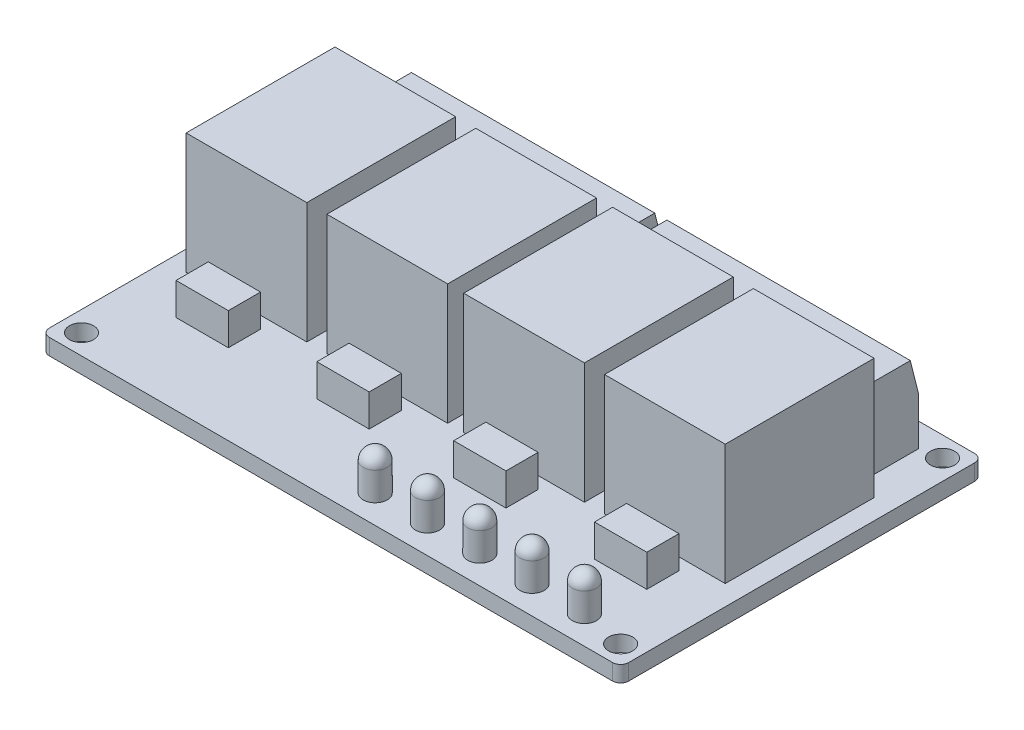
from build123d import *

# Parameters (mm, degrees)
SKETCH1_R           = 1.5
BOSS_EXTRUDE1_DEPTH = 2
SKETCH2_W           = 30.25
SKETCH2_H           = 7
BOSS_EXTRUDE2_DEPTH = 10
CUT_EXTRUDE1_DEPTH  = 72.688562547
SKETCH4_W           = 15
SKETCH4_H           = 18.5
BOSS_EXTRUDE3_DEPTH = 15
SKETCH5_W           = 6.5
SKETCH5_H           = 4
BOSS_EXTRUDE4_DEPTH = 4
SKETCH6_R           = 1.5
BOSS_EXTRUDE5_DEPTH = 5
FILLET1_R           = 1.5
FILLET2_R           = 1.5
FILLET3_R           = 1.5
FILLET4_R           = 1.5
FILLET5_R           = 1.5


with BuildPart() as part:
    # Sketch1 → Boss-Extrude1 (new body)
    with BuildSketch(Plane(origin=(0, 0, 0), x_dir=(1, 0, 0), z_dir=(0, 1, 0))):
        with BuildLine():
            Line((-35, -22.5), (35, -22.5))
            ThreePointArc((35, -22.5), (35.707106781, -22.207106781), (36, -21.5))
            Line((36, -21.5), (36, 21.5))
            ThreePointArc((36, 21.5), (35.707106781, 22.207106781), (35, 22.5))
            Line((35, 22.5), (-35, 22.5))
            ThreePointArc((-35, 22.5), (-35.707106781, 22.207106781), (-36, 21.5))
            Line((-36, 21.5), (-36, -21.5))
            ThreePointArc((-36, -21.5), (-35.707106781, -22.207106781), (-35, -22.5))
        make_face()
        with Locations(Location((-33.5, 20, 0), (0, 0, 270))):
            Circle(SKETCH1_R, mode=Mode.SUBTRACT)
        with Locations(Location((33.5, 20, 0), (0, 0, 90))):
            Circle(SKETCH1_R, mode=Mode.SUBTRACT)
        with Locations(Location((33.5, -20, 0), (0, 0, 270))):
            Circle(SKETCH1_R, mode=Mode.SUBTRACT)
        with Locations(Location((-33.5, -20, 0), (0, 0, 90))):
            Circle(SKETCH1_R, mode=Mode.SUBTRACT)
    extrude(amount=BOSS_EXTRUDE1_DEPTH)

    # Sketch2 → Boss-Extrude2 (add)
    with BuildSketch(Plane(origin=(0, 2, 0), x_dir=(1, 0, 0), z_dir=(0, 1, 0))):
        with Locations((-15.875, 16)):
            Rectangle(SKETCH2_W, SKETCH2_H)
        with Locations((15.875, 16)):
            Rectangle(SKETCH2_W, SKETCH2_H)
    extrude(amount=BOSS_EXTRUDE2_DEPTH)

    # Sketch3 → Cut-Extrude1 (cut, through all)
    with BuildSketch(Plane.ZY.offset(31)):
        Polygon((-19.5, 8), (-18.5, 12), (-19.5, 12), align=None)
        Polygon((-12.5, 8), (-14, 12), (-12.5, 12), align=None)
    extrude(amount=-CUT_EXTRUDE1_DEPTH, mode=Mode.SUBTRACT)

    # Sketch4 → Boss-Extrude3 (add)
    with BuildSketch(Plane(origin=(0, 2, 0), x_dir=(1, 0, 0), z_dir=(0, 1, 0))):
        with Locations((26, 2.25)):
            Rectangle(SKETCH4_W, SKETCH4_H)
        with Locations((8.5, 2.25)):
            Rectangle(SKETCH4_W, SKETCH4_H)
        with Locations((-8.5, 2.25)):
            Rectangle(SKETCH4_W, SKETCH4_H)
        with Locations((-26, 2.25)):
            Rectangle(SKETCH4_W, SKETCH4_H)
    extrude(amount=BOSS_EXTRUDE3_DEPTH)

    # Sketch5 → Boss-Extrude4 (add)
    with BuildSketch(Plane(origin=(0, 2, 0), x_dir=(1, 0, 0), z_dir=(0, 1, 0))):
        with Locations((-26, -10.5)):
            Rectangle(SKETCH5_W, SKETCH5_H)
        with Locations((-8.5, -10.5)):
            Rectangle(SKETCH5_W, SKETCH5_H)
        with Locations((8.5, -10.5)):
            Rectangle(SKETCH5_W, SKETCH5_H)
        with Locations((26, -10.5)):
            Rectangle(SKETCH5_W, SKETCH5_H)
    extrude(amount=BOSS_EXTRUDE4_DEPTH)

    # Sketch6 → Boss-Extrude5 (add)
    with BuildSketch(Plane(origin=(0, 2, 0), x_dir=(1, 0, 0), z_dir=(0, 1, 0))):
        with Locations(Location((28, -19, 0), (0, 0, 90))):
            Circle(SKETCH6_R)
        with Locations(Location((21.5, -19, 0), (0, 0, 90))):
            Circle(SKETCH6_R)
        with Locations(Location((15, -19, 0), (0, 0, 90))):
            Circle(SKETCH6_R)
        with Locations(Location((8.5, -19, 0), (0, 0, 90))):
            Circle(SKETCH6_R)
        with Locations(Location((2, -19, 0), (0, 0, 90))):
            Circle(SKETCH6_R)
    extrude(amount=BOSS_EXTRUDE5_DEPTH)

    # Fillet1
    fillet1_edges = [part.edges().sort_by_distance(p)[0] for p in [
        (2, 7, 20.5),
    ]]
    fillet(fillet1_edges, radius=FILLET1_R)

    # Fillet2
    fillet2_edges = [part.edges().sort_by_distance(p)[0] for p in [
        (8.5, 7, 20.5),
    ]]
    fillet(fillet2_edges, radius=FILLET2_R)

    # Fillet3
    fillet3_edges = [part.edges().sort_by_distance(p)[0] for p in [
        (15, 7, 20.5),
    ]]
    fillet(fillet3_edges, radius=FILLET3_R)

    # Fillet4
    fillet4_edges = [part.edges().sort_by_distance(p)[0] for p in [
        (21.5, 7, 20.5),
    ]]
    fillet(fillet4_edges, radius=FILLET4_R)

    # Fillet5
    fillet5_edges = [part.edges().sort_by_distance(p)[0] for p in [
        (28, 7, 20.5),
    ]]
    fillet(fillet5_edges, radius=FILLET5_R)


solid = part.part
